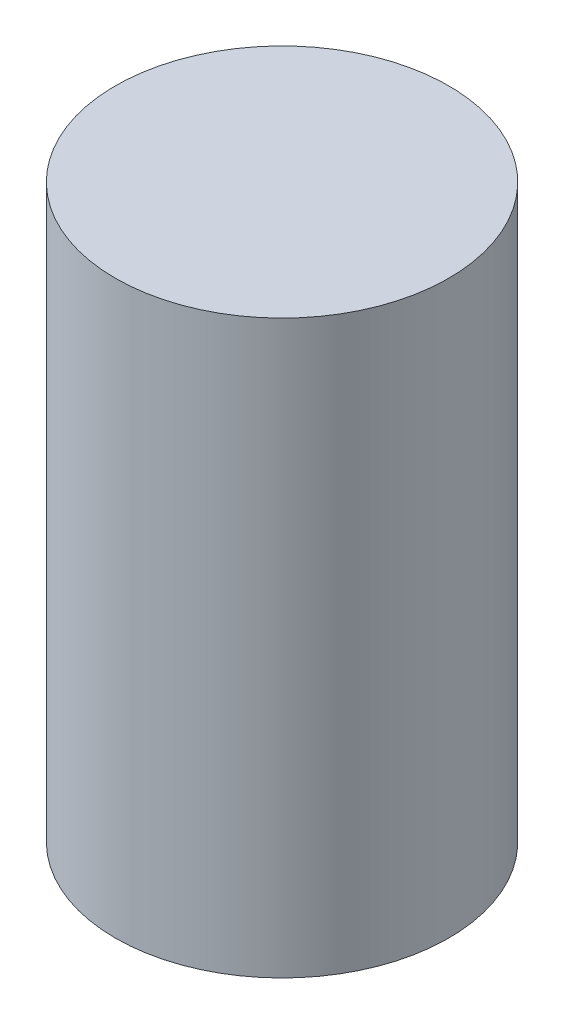
from build123d import *


with BuildPart() as part:
    # Sketch1 → Revolve1 (revolve)
    with BuildSketch(Plane.XY, mode=Mode.PRIVATE) as revolve1_sk:
        Polygon((-2.5, 0), (-6.3, 0), (-6.3, 21.6), (0, 21.6), (0, 0), (0, -1.5), (-2.5, -1.5), align=None)
    revolve(revolve1_sk.sketch.rotate(Axis((0, 0, 0), (0, -1, 0)), 270), axis=Axis((0, 0, 0), (0, -1, 0)))


solid = part.part
